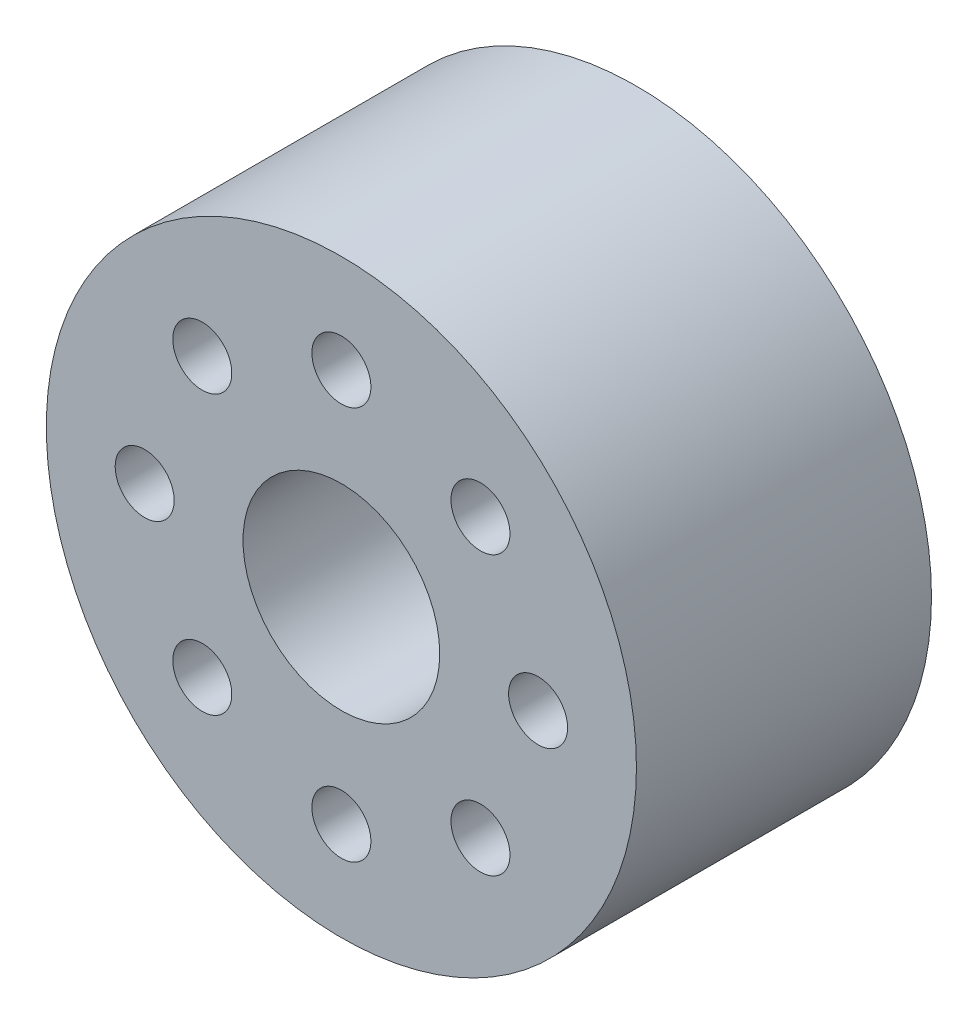
from build123d import *

# Parameters (mm, degrees)
SKETCH1_R                                           = 12
BOSS_EXTRUDE1_DEPTH                                 = 12
F_8_0MM_DOWEL_HOLE1_D                               = 8
CBORE_FOR_M2_HEX_SOCKET_HEAD_CAP_SCREW1_D           = 2.4
CBORE_FOR_M2_HEX_SOCKET_HEAD_CAP_SCREW1_CBORE_D     = 4.4
CBORE_FOR_M2_HEX_SOCKET_HEAD_CAP_SCREW1_CBORE_DEPTH = 5.5


with BuildPart() as part:
    # Sketch1 → Boss-Extrude1 (new body)
    with BuildSketch(Plane.XY):
        Circle(SKETCH1_R)
    extrude(amount=BOSS_EXTRUDE1_DEPTH)

    # Ø8.0mm Dowel Hole1 (through all)
    with Locations(Plane.XY.offset(12)):
        with Locations((0, 0)):
            Hole(F_8_0MM_DOWEL_HOLE1_D / 2)

    # CBORE for M2 Hex Socket Head Cap Screw1 (through all)
    with Locations(Plane(origin=(0, 0, 0), x_dir=(1, 0, 0), z_dir=(0, 0, -1))):
        with Locations((-5.656854249, -5.656854249), (0, -8), (5.656854249, -5.656854249), (8, 0), (5.656854249, 5.656854249), (0, 8), (-5.656854249, 5.656854249), (-8, 0)):
            CounterBoreHole(CBORE_FOR_M2_HEX_SOCKET_HEAD_CAP_SCREW1_D / 2, CBORE_FOR_M2_HEX_SOCKET_HEAD_CAP_SCREW1_CBORE_D / 2, CBORE_FOR_M2_HEX_SOCKET_HEAD_CAP_SCREW1_CBORE_DEPTH)


solid = part.part
